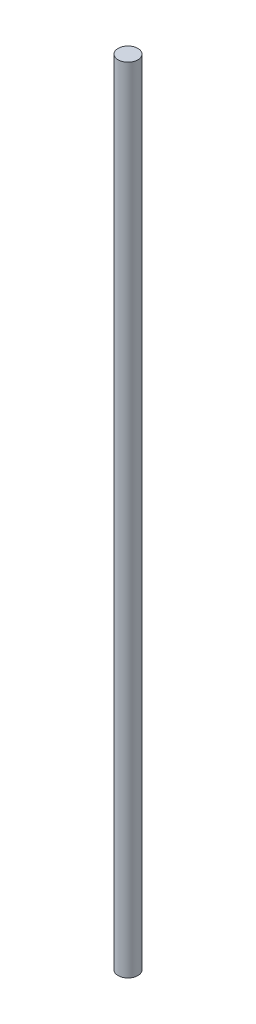
from build123d import *

# Parameters (mm, degrees)
BOSS_EXTRUDE1_DEPTH      = 250
BOSS_EXTRUDE1_DEPTH_BACK = 250
SKETCH1_R                = 6.25


with BuildPart() as part:
    # Sketch1 → Boss-Extrude1 (new, two sides: drawn at the far end of the back side and taken through both)
    with BuildSketch(Plane(origin=(0, 0, 0), x_dir=(1, 0, 0), z_dir=(0, 1, 0)).offset(-BOSS_EXTRUDE1_DEPTH_BACK)):
        Circle(SKETCH1_R)
    extrude(amount=BOSS_EXTRUDE1_DEPTH + BOSS_EXTRUDE1_DEPTH_BACK)


solid = part.part
